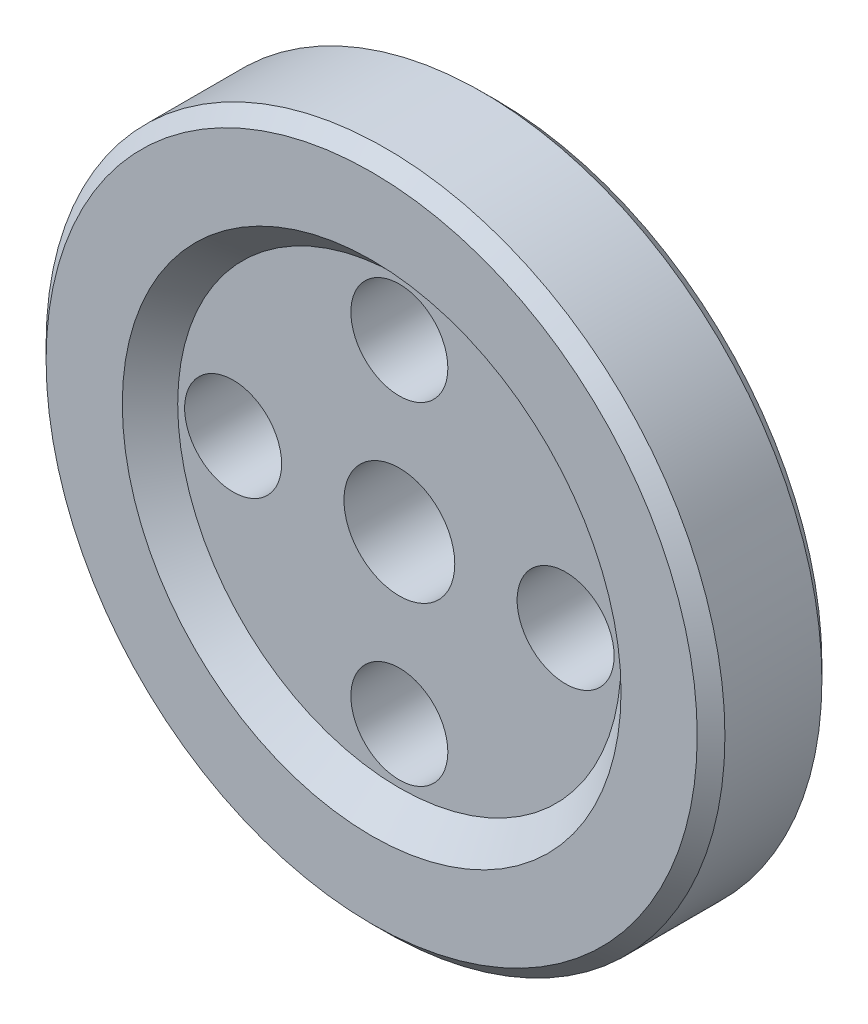
from build123d import *

# Parameters (mm, degrees)
SKETCH1_R           = 24.5
SKETCH1_R_2         = 18
BOSS_EXTRUDE1_DEPTH = 9
SKETCH1_3_R         = 18
SKETCH1_3_R_2       = 3.5
SKETCH1_3_R_3       = 4
BOSS_EXTRUDE2_DEPTH = 7


with BuildPart() as part:
    # Sketch1 → Boss-Extrude1 (new body)
    with BuildSketch(Plane.XY):
        Circle(SKETCH1_R)
        Circle(SKETCH1_R_2, mode=Mode.SUBTRACT)
    extrude(amount=BOSS_EXTRUDE1_DEPTH)

    # Sketch1<3> → Boss-Extrude2 (add)
    with BuildSketch(Plane.XY):
        Circle(SKETCH1_3_R)
        with Locations((0, -12)):
            Circle(SKETCH1_3_R_2, mode=Mode.SUBTRACT)
        Circle(SKETCH1_3_R_3, mode=Mode.SUBTRACT)
        with Locations((12, 0)):
            Circle(SKETCH1_3_R_2, mode=Mode.SUBTRACT)
        with Locations((-12, 0)):
            Circle(SKETCH1_3_R_2, mode=Mode.SUBTRACT)
        with Locations((0, 12)):
            Circle(SKETCH1_3_R_2, mode=Mode.SUBTRACT)
    extrude(amount=BOSS_EXTRUDE2_DEPTH)

    # Sketch3 → Revolve2 (revolve)
    with BuildSketch(Plane(origin=(0, 0, 0), x_dir=(1, 0, 0), z_dir=(0, 1, 0))):
        Polygon((-18, -9), (-16, -7), (-18, -7), align=None)
    revolve(axis=Axis((0, 0, -3.771799992), (0, 0, 1)))

    # Sketch4 → Cut-Revolve1 (revolve, cut)
    with BuildSketch(Plane(origin=(0, 0, 0), x_dir=(1, 0, 0), z_dir=(0, 1, 0))):
        Polygon((-24.5, -8), (-23.5, -9), (-24.5, -9), align=None)
        Polygon((-24.5, -1), (-23.5, 0), (-24.5, 0), align=None)
    revolve(axis=Axis((0, 0, -7.551154296), (0, 0, 1)), mode=Mode.SUBTRACT)


solid = part.part
